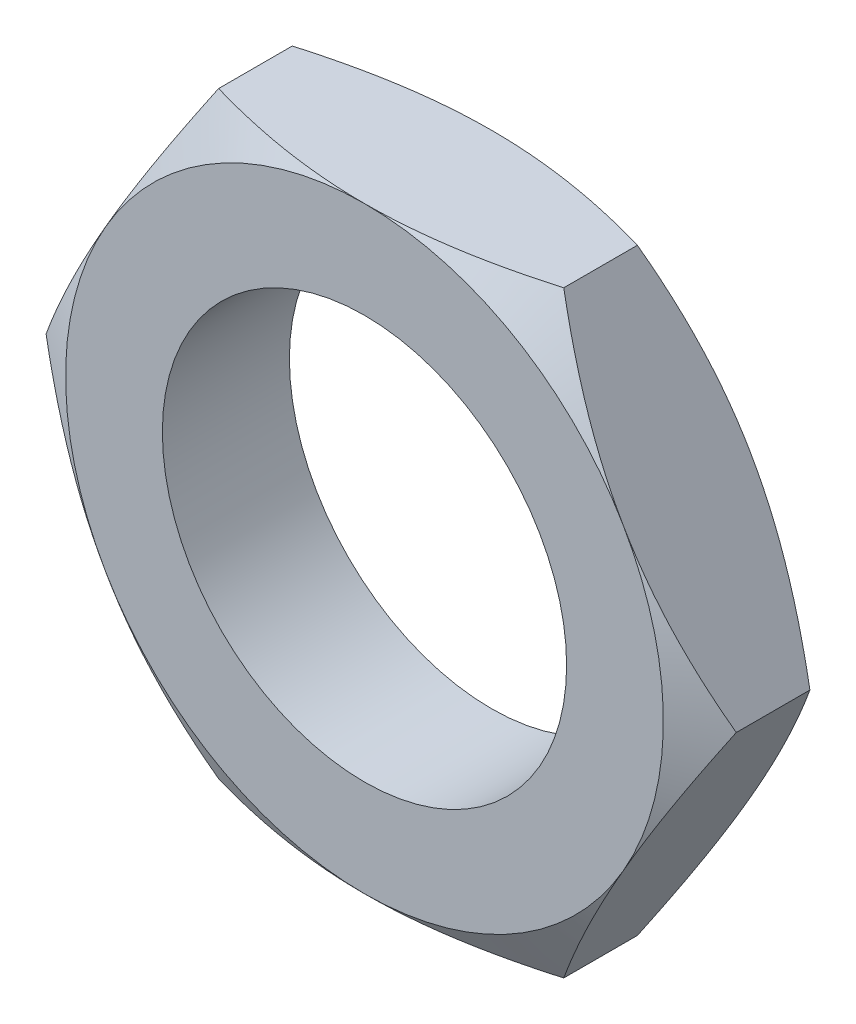
from build123d import *

# Parameters (mm, degrees)
BOSS_EXTRUDE1_DEPTH       = 0.85
SKETCH2_R                 = 15
SKETCH2_R_2               = 4
CUT_EXTRUDE_THIN2_DEPTH   = 1
CUT_EXTRUDE_THIN2_DRAFT   = -60
MIRROR1_COPY_1_SKETCH_R   = 15
MIRROR1_COPY_1_SKETCH_R_2 = 4
MIRROR1_COPY_1_DEPTH      = 1
MIRROR1_COPY_1_DRAFT      = -60
F_1_4_28_TAPPED_HOLE1_D   = 5.4102


with BuildPart() as part:
    # Sketch1 → Boss-Extrude1 (new, symmetric)
    with BuildSketch(Plane.XY):
        Polygon((2.309401077, 4), (-2.309401077, 4), (-4.618802154, 0), (-2.309401077, -4), (2.309401077, -4), (4.618802154, 0), align=None)
    extrude(amount=BOSS_EXTRUDE1_DEPTH, both=True)


with BuildPart() as cut_extrude_thin2_tool:
    # Sketch2 → Cut-Extrude-Thin2 (with draft: the straight prism first)
    with BuildSketch(Plane.XY.offset(0.85)):
        Circle(SKETCH2_R)
        Circle(SKETCH2_R_2, mode=Mode.SUBTRACT)
    extrude(amount=-CUT_EXTRUDE_THIN2_DEPTH)
    # Cut-Extrude-Thin2: the draft: its side faces are tilted about the plane it starts from
    cut_extrude_thin2_sides = [cut_extrude_thin2_tool.faces().sort_by_distance(p)[0] for p in [
        (-15, 0, 0.35),
        (-4, 0, 0.35),
    ]]
    draft(cut_extrude_thin2_sides, Plane.XY.offset(0.85), CUT_EXTRUDE_THIN2_DRAFT)


with BuildPart() as part_1:
    add(part.part)

    # Cut-Extrude-Thin2: cut by cut_extrude_thin2_tool
    add(cut_extrude_thin2_tool.part, mode=Mode.SUBTRACT)


with BuildPart() as mirror1_copy_1_tool:
    # Mirror1 copy 1 sketch → Mirror1 copy 1 (with draft: the straight prism first)
    with BuildSketch(Plane(origin=(0, 0, -0.85), x_dir=(1, 0, 0), z_dir=(0, 0, -1))):
        Circle(MIRROR1_COPY_1_SKETCH_R)
        Circle(MIRROR1_COPY_1_SKETCH_R_2, mode=Mode.SUBTRACT)
    extrude(amount=-MIRROR1_COPY_1_DEPTH)
    # Mirror1 copy 1: the draft: its side faces are tilted about the plane it starts from
    mirror1_copy_1_sides = [mirror1_copy_1_tool.faces().sort_by_distance(p)[0] for p in [
        (-15, 0, -0.35),
        (-4, 0, -0.35),
    ]]
    draft(mirror1_copy_1_sides, Plane(origin=(0, 0, -0.85), x_dir=(1, 0, 0), z_dir=(0, 0, -1)), MIRROR1_COPY_1_DRAFT)


with BuildPart() as part_2:
    add(part_1.part)

    # Mirror1 copy 1: cut by mirror1_copy_1_tool
    add(mirror1_copy_1_tool.part, mode=Mode.SUBTRACT)

    # 1/4-28 Tapped Hole1 (through all)
    with Locations(Plane.XY.offset(0.85)):
        with Locations((0, 0)):
            Hole(F_1_4_28_TAPPED_HOLE1_D / 2)


solid = part_2.part
